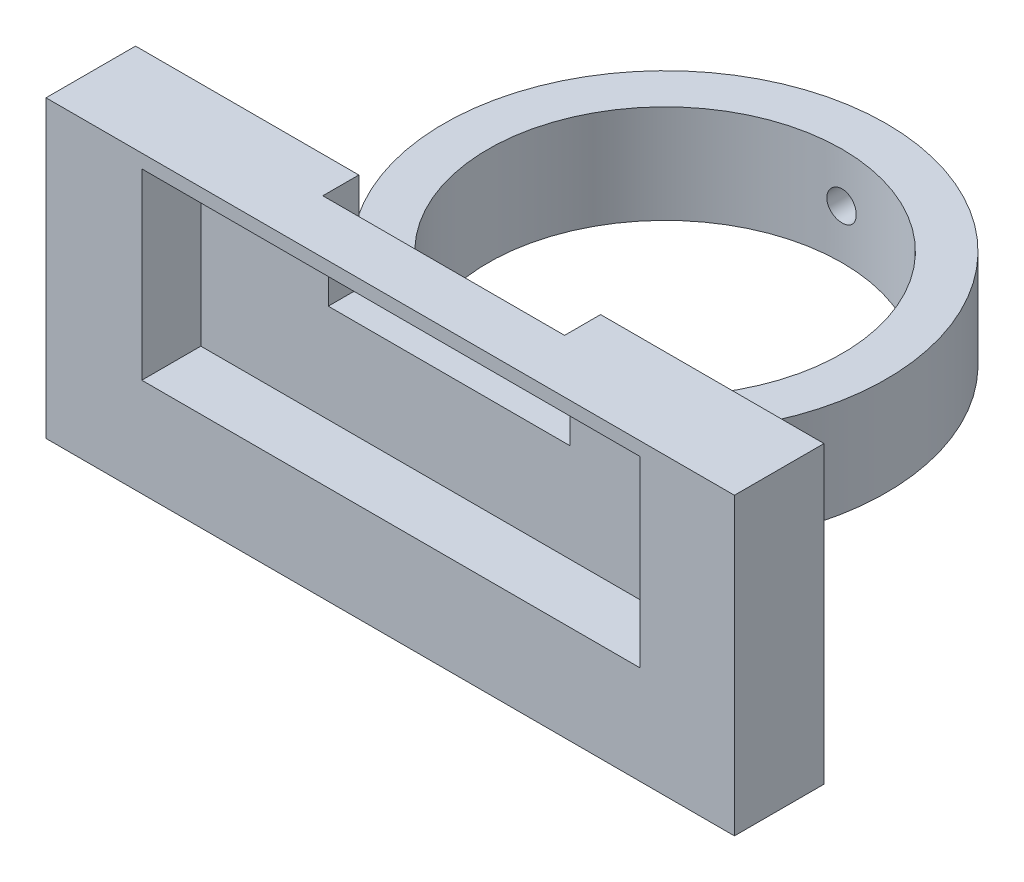
from build123d import *

# Parameters (mm, degrees)
CROQUIS1_R                   = 22.5
CROQUIS1_R_2                 = 18
SALIENTE_EXTRUIR1_DEPTH      = 10
SALIENTE_EXTRUIR2_DEPTH      = 10
SALIENTE_EXTRUIR2_DEPTH_BACK = 20
CROQUIS3_W                   = 70
CROQUIS3_H                   = 9.106451256
CROQUIS5_R                   = 1.5
CORTAR_EXTRUIR1_DEPTH        = 50.053642187
CROQUIS7_W                   = 50
CROQUIS7_H                   = 10.485407271
CORTAR_EXTRUIR2_DEPTH        = 5
CROQUIS8_W                   = 50.630312491
CROQUIS8_H                   = 6
CORTAR_EXTRUIR3_DEPTH        = 20
CROQUIS11_W                  = 24.591659355
CROQUIS11_H                  = 8.221287074
CORTAR_EXTRUIR4_DEPTH        = 16
CROQUIS12_W                  = 6
CROQUIS12_H                  = 1.38614326
SALIENTE_EXTRUIR3_DEPTH      = 56
CROQUIS13_W                  = 24.583761772
CROQUIS13_H                  = 3.662244936
CORTAR_EXTRUIR5_DEPTH        = 5


with BuildPart() as part:
    # Croquis1 → Saliente-Extruir1 (new body)
    with BuildSketch(Plane(origin=(0, 0, 0), x_dir=(1, 0, 0), z_dir=(0, 1, 0))):
        with Locations(Location((0, 0, 0), (0, 0, 270))):
            Circle(CROQUIS1_R)
        with Locations(Location((0, 0, 0), (0, 0, 270))):
            Circle(CROQUIS1_R_2, mode=Mode.SUBTRACT)
    extrude(amount=SALIENTE_EXTRUIR1_DEPTH)

    # Croquis3 → Saliente-Extruir2 (add, two sides: drawn at the far end of the back side and taken through both)
    with BuildSketch(Plane(origin=(0, 10, 0), x_dir=(1, 0, 0), z_dir=(0, 1, 0)).offset(-SALIENTE_EXTRUIR2_DEPTH_BACK)):
        with Locations((0, -23.39779961)):
            Rectangle(CROQUIS3_W, CROQUIS3_H)
    extrude(amount=SALIENTE_EXTRUIR2_DEPTH + SALIENTE_EXTRUIR2_DEPTH_BACK)

    # Croquis5 → Cortar-Extruir1 (cut, through all)
    with BuildSketch(Plane.XY):
        with Locations(Location((0, 5, 0), (0, 0, 90))):
            Circle(CROQUIS5_R)
    extrude(amount=-CORTAR_EXTRUIR1_DEPTH, mode=Mode.SUBTRACT)

    # Croquis7 → Cortar-Extruir2 (cut)
    with BuildSketch(Plane.XY.offset(27.951025238)):
        with Locations((0, 6.110348598)):
            Rectangle(CROQUIS7_W, CROQUIS7_H)
    extrude(amount=-CORTAR_EXTRUIR2_DEPTH, mode=Mode.SUBTRACT)

    # Croquis8 → Cortar-Extruir3 (cut)
    with BuildSketch(Plane(origin=(0, 20, 0), x_dir=(1, 0, 0), z_dir=(0, 1, 0))):
        with Locations((0.058181837, -24.951025238)):
            Rectangle(CROQUIS8_W, CROQUIS8_H)
    extrude(amount=-CORTAR_EXTRUIR3_DEPTH, mode=Mode.SUBTRACT)

    # Croquis11 → Cortar-Extruir4 (cut)
    with BuildSketch(Plane(origin=(0, 0, 18.844573982), x_dir=(-1, 0, 0), z_dir=(0, 0, -1))):
        with Locations((0.00225284, 14.110643537)):
            Rectangle(CROQUIS11_W, CROQUIS11_H)
    extrude(amount=-CORTAR_EXTRUIR4_DEPTH, mode=Mode.SUBTRACT)

    # Croquis12 → Saliente-Extruir3 (add)
    with BuildSketch(Plane.ZY.offset(-25.373338083)):
        with Locations((24.951025238, 19.30692837)):
            Rectangle(CROQUIS12_W, CROQUIS12_H)
    extrude(amount=SALIENTE_EXTRUIR3_DEPTH)

    # Croquis13 → Cortar-Extruir5 (cut)
    with BuildSketch(Plane(origin=(0, 20, 0), x_dir=(1, 0, 0), z_dir=(0, 1, 0))):
        with Locations((-0.006201632, -20.67569645)):
            Rectangle(CROQUIS13_W, CROQUIS13_H)
    extrude(amount=-CORTAR_EXTRUIR5_DEPTH, mode=Mode.SUBTRACT)


solid = part.part
